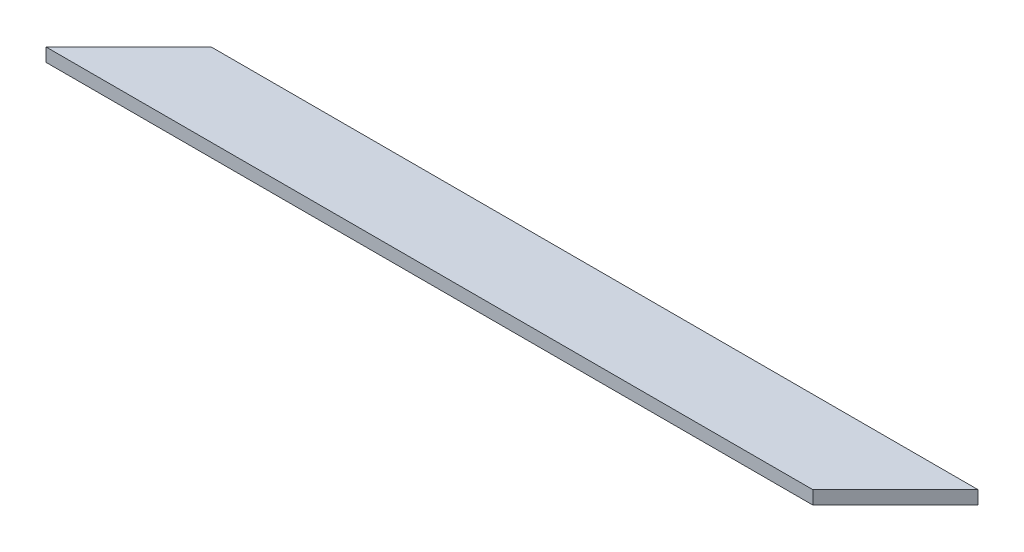
from build123d import *

# Parameters (mm, degrees)
BOSS_EXTRUDE1_DEPTH = 21.59


with BuildPart() as part:
    # Sketch2 → Boss-Extrude1 (new body)
    with BuildSketch(Plane(origin=(0, 0, 0), x_dir=(1, 0, 0), z_dir=(0, 1, 0))):
        Polygon((-6617.49375, 2309.8125), (-5379.24375, 2309.8125), (-5512.59375, 2176.4625), (-6750.84375, 2176.4625), align=None)
    extrude(amount=BOSS_EXTRUDE1_DEPTH)


solid = part.part
